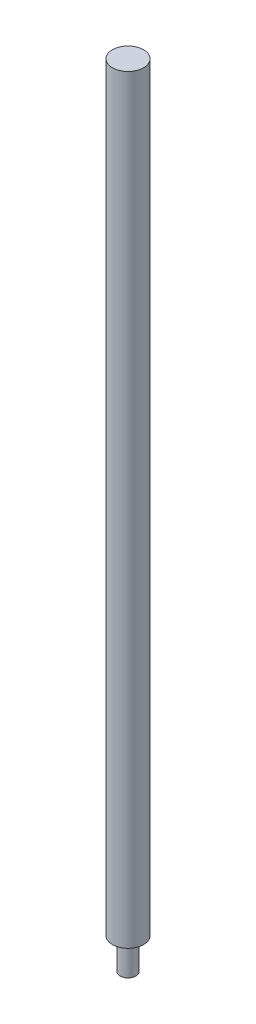
from build123d import *

# Parameters (mm, degrees)
SKETCH1_R           = 4.7625
BOSS_EXTRUDE1_DEPTH = 241.3
SKETCH2_R           = 4.7625
SKETCH2_R_2         = 2.38125
CUT_EXTRUDE1_DEPTH  = 9.525


with BuildPart() as part:
    # Sketch1 → Boss-Extrude1 (new body)
    with BuildSketch(Plane(origin=(0, 0, 0), x_dir=(1, 0, 0), z_dir=(0, 1, 0))):
        with Locations(Location((0, 0, 0), (0, 0, 90))):
            Circle(SKETCH1_R)
    extrude(amount=BOSS_EXTRUDE1_DEPTH)

    # Sketch2 → Cut-Extrude1 (cut)
    with BuildSketch(Plane.XZ):
        with Locations(Location((0, 0, 0), (0, 0, 270))):
            Circle(SKETCH2_R)
        with Locations(Location((0, 0, 0), (0, 0, 270))):
            Circle(SKETCH2_R_2, mode=Mode.SUBTRACT)
    extrude(amount=-CUT_EXTRUDE1_DEPTH, mode=Mode.SUBTRACT)


solid = part.part
